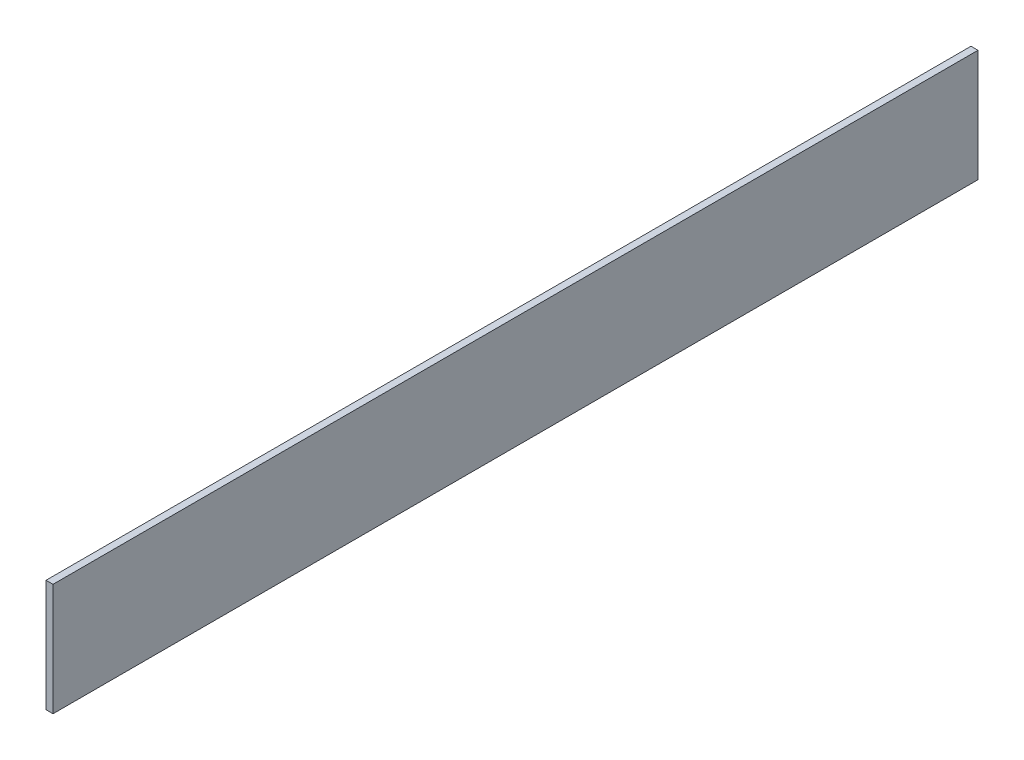
from build123d import *

# Parameters (mm, degrees)
PACK_KALIP_DUVARI_SOL_1_START = -235
SKETCH1_W                     = 2.5
SKETCH1_H                     = 40
PACK_KALIP_DUVARI_SOL_1_DEPTH = 330


with BuildPart() as part:
    # Sketch1 → PACK_kalip_duvari_sol_1 (new body)
    with BuildSketch(Plane.XY.offset(PACK_KALIP_DUVARI_SOL_1_START)):
        with Locations((186.25, 572)):
            Rectangle(SKETCH1_W, SKETCH1_H)
    extrude(amount=-PACK_KALIP_DUVARI_SOL_1_DEPTH)


solid = part.part
